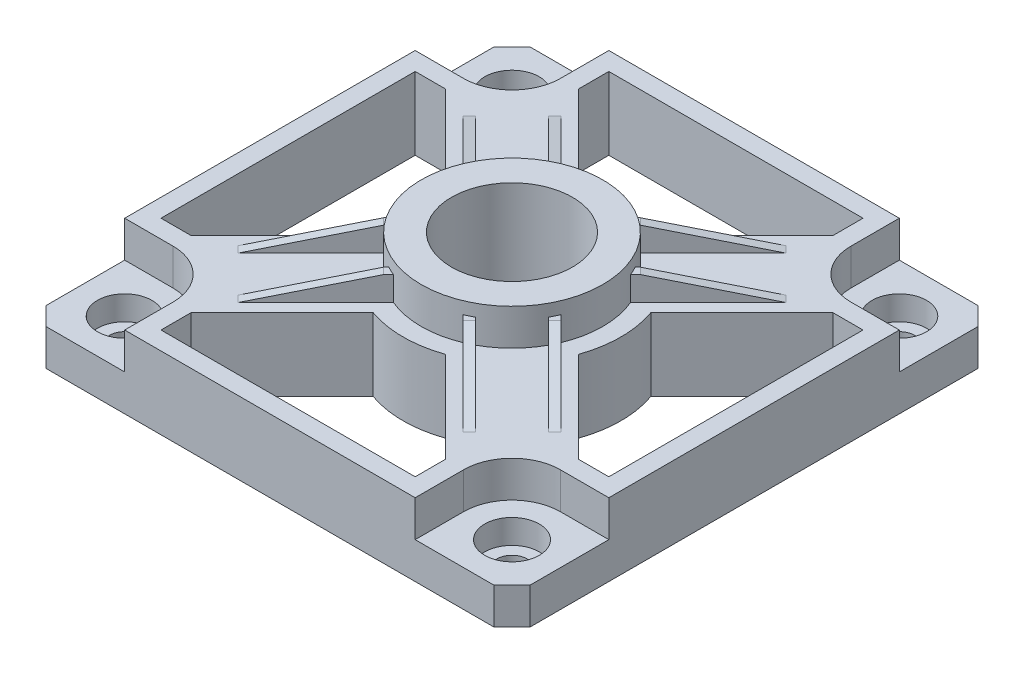
from build123d import *

# Parameters (mm, degrees)
SKETCH1_W                = 80
SKETCH1_H                = 80
BOSS_EXTRUDE1_DEPTH      = 12
CHAMFER1_SIZE            = 3
CUT_EXTRUDE1_DEPTH       = 6
MIRROR2_COPY_1_DEPTH     = 6
HOLE3_D                  = 5
HOLE3_CBORE_D            = 9
HOLE3_CBORE_DEPTH        = 4
SKETCH9_R                = 15
BOSS_EXTRUDE2_DEPTH      = 6
CUT_EXTRUDE2_DEPTH       = 60.363288319
CIRPATTERN1_COUNT        = 4
BOSS_EXTRUDE3_START      = 5
BOSS_EXTRUDE3_DEPTH      = 0.75
CIRPATTERN2_COUNT        = 4
CIRPATTERN2_START        = 5
CIRPATTERN2_COPY_1_DEPTH = 0.75
CIRPATTERN2_COPY_2_DEPTH = 0.75
CIRPATTERN2_COPY_3_DEPTH = 0.75
HOLE4_D                  = 20


with BuildPart() as part:
    # Sketch1 → Boss-Extrude1 (new body)
    with BuildSketch(Plane(origin=(0, 0, 0), x_dir=(1, 0, 0), z_dir=(0, 1, 0))):
        Rectangle(SKETCH1_W, SKETCH1_H)
    extrude(amount=BOSS_EXTRUDE1_DEPTH)

    # Chamfer1
    chamfer1_edges = [part.edges().sort_by_distance(p)[0] for p in [
        (40, 6, 40),
        (-40, 6, 40),
        (-40, 6, -40),
        (40, 6, -40),
    ]]
    chamfer(chamfer1_edges, length=CHAMFER1_SIZE)

    # Sketch2 → Cut-Extrude1 (cut)
    with BuildSketch(Plane(origin=(0, 12, 0), x_dir=(1, 0, 0), z_dir=(0, 1, 0))):
        with BuildLine():
            Line((-40, -24), (-32, -24))
            ThreePointArc((-32, -24), (-26.343145751, -26.343145751), (-24, -32))
            Line((-24, -32), (-24, -40))
            Line((-24, -40), (-37, -40))
            Line((-37, -40), (-40, -37))
            Line((-40, -37), (-40, -24))
        make_face()
    cut_extrude1 = extrude(amount=-CUT_EXTRUDE1_DEPTH, mode=Mode.SUBTRACT)

    # Mirror1: Cut-Extrude1 across plane
    add(cut_extrude1.mirror(Plane(origin=(0, 0, 0), x_dir=(0, 0, 1), z_dir=(1, 0, 0))), mode=Mode.SUBTRACT)

    # Mirror2: Cut-Extrude1 across plane
    add(cut_extrude1.mirror(Plane.XY), mode=Mode.SUBTRACT)

    # Mirror2 copy 1 sketch → Mirror2 copy 1 (cut)
    with BuildSketch(Plane(origin=(0, 12, 0), x_dir=(-1, 0, 0), z_dir=(0, 1, 0))):
        with BuildLine():
            Line((-40, -24), (-32, -24))
            ThreePointArc((-32, -24), (-26.343145751, -26.343145751), (-24, -32))
            Line((-24, -32), (-24, -40))
            Line((-24, -40), (-37, -40))
            Line((-37, -40), (-40, -37))
            Line((-40, -37), (-40, -24))
        make_face()
    extrude(amount=-MIRROR2_COPY_1_DEPTH, mode=Mode.SUBTRACT)

    # Hole3 (through all)
    with Locations(Plane(origin=(0, 6, 0), x_dir=(1, 0, 0), z_dir=(0, 1, 0))):
        with Locations((-32, -32), (32, -32), (32, 32), (-32, 32)):
            CounterBoreHole(HOLE3_D / 2, HOLE3_CBORE_D / 2, HOLE3_CBORE_DEPTH)

    # Sketch9 → Boss-Extrude2 (add)
    with BuildSketch(Plane(origin=(0, 12, 0), x_dir=(1, 0, 0), z_dir=(0, 1, 0))):
        with Locations(Location((0, 0, 0), (0, 0, 270))):
            Circle(SKETCH9_R)
    extrude(amount=BOSS_EXTRUDE2_DEPTH)

    # Sketch10 → Cut-Extrude2 (cut, through all)
    with BuildSketch(Plane(origin=(0, 18, 0), x_dir=(1, 0, 0), z_dir=(0, 1, 0))):
        with BuildLine():
            Line((-21, 37), (-21, 32))
            Line((-21, 32), (-5.978240283, 16.978240283))
            ThreePointArc((-5.978240283, 16.978240283), (0, 18), (5.978240283, 16.978240283))
            Line((5.978240283, 16.978240283), (21, 32))
            Line((21, 32), (21, 37))
            Line((21, 37), (-21, 37))
        make_face()
    cut_extrude2 = extrude(amount=-CUT_EXTRUDE2_DEPTH, mode=Mode.SUBTRACT)

    # CirPattern1: Cut-Extrude2 ×4 about axis
    cirpattern1_axis = Axis((0, 0, 0), (0, 1, 0))
    for i in range(1, CIRPATTERN1_COUNT):
        add(cut_extrude2.rotate(cirpattern1_axis, i * 360 / CIRPATTERN1_COUNT), mode=Mode.SUBTRACT)

    # Sketch12 → Boss-Extrude3 (add, symmetric)
    with BuildSketch(Plane(origin=(0, 0, 0), x_dir=(0.7071067811865491, 0, -0.707106781186546), z_dir=(0.707106781186546, 0, 0.7071067811865491)).offset(BOSS_EXTRUDE3_START)):
        Polygon((12, 12), (32, 12), (15, 16), (12, 16), align=None)
    boss_extrude3 = extrude(amount=BOSS_EXTRUDE3_DEPTH, both=True)

    # Mirror4: Boss-Extrude3 across plane
    add(boss_extrude3.mirror(Plane(origin=(0, 0, 0), x_dir=(-0.7071067811865492, 0, 0.7071067811865459), z_dir=(0.707106781186546, 0, 0.7071067811865491))))

    # CirPattern2: Boss-Extrude3 ×4 about axis
    cirpattern2_axis = Axis((0, 0, 0), (0, 1, 0))
    for i in range(1, CIRPATTERN2_COUNT):
        add(boss_extrude3.rotate(cirpattern2_axis, i * 360 / CIRPATTERN2_COUNT))

    # CirPattern2 copy 1 sketch → CirPattern2 copy 1 (add, symmetric)
    with BuildSketch(Plane(origin=(0, 0, 0), x_dir=(-0.707106781186546, 0, -0.7071067811865491), z_dir=(-0.7071067811865493, 0, 0.7071067811865462)).offset(CIRPATTERN2_START)):
        Polygon((12, -12), (32, -12), (15, -16), (12, -16), align=None)
    extrude(amount=CIRPATTERN2_COPY_1_DEPTH, both=True)

    # CirPattern2 copy 2 sketch → CirPattern2 copy 2 (add, symmetric)
    with BuildSketch(Plane(origin=(0, 0, 0), x_dir=(-0.7071067811865492, 0, 0.707106781186546), z_dir=(0.7071067811865461, 0, 0.7071067811865493)).offset(CIRPATTERN2_START)):
        Polygon((12, -12), (32, -12), (15, -16), (12, -16), align=None)
    extrude(amount=CIRPATTERN2_COPY_2_DEPTH, both=True)

    # CirPattern2 copy 3 sketch → CirPattern2 copy 3 (add, symmetric)
    with BuildSketch(Plane(origin=(0, 0, 0), x_dir=(0.707106781186546, 0, 0.7071067811865492), z_dir=(0.7071067811865493, 0, -0.7071067811865461)).offset(CIRPATTERN2_START)):
        Polygon((12, -12), (32, -12), (15, -16), (12, -16), align=None)
    extrude(amount=CIRPATTERN2_COPY_3_DEPTH, both=True)

    # Hole4 (through all)
    with Locations(Plane(origin=(0, 18, 0), x_dir=(1, 0, 0), z_dir=(0, 1, 0))):
        with Locations((0, 0)):
            Hole(HOLE4_D / 2)


solid = part.part
